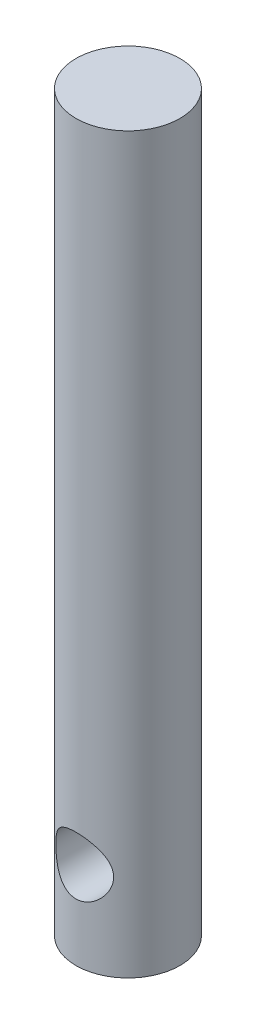
from build123d import *

# Parameters (mm, degrees)
SKETCH5_R           = 9
BOSS_EXTRUDE2_DEPTH = 127
SKETCH7_R           = 5
CUT_EXTRUDE2_DEPTH  = 50


with BuildPart() as part:
    # Sketch5 → Boss-Extrude2 (new body)
    with BuildSketch(Plane(origin=(0, 0, 0), x_dir=(1, 0, 0), z_dir=(0, 1, 0))):
        with Locations(Location((32.666511495, 0, 0), (0, 0, 270))):
            Circle(SKETCH5_R)
    extrude(amount=BOSS_EXTRUDE2_DEPTH)

    # Sketch7 → Cut-Extrude2 (cut)
    with BuildSketch(Plane.XY.offset(9)):
        with Locations(Location((32.666511495, 15, 0), (0, 0, 89.999999967))):
            Circle(SKETCH7_R)
    extrude(amount=-CUT_EXTRUDE2_DEPTH, mode=Mode.SUBTRACT)


solid = part.part
